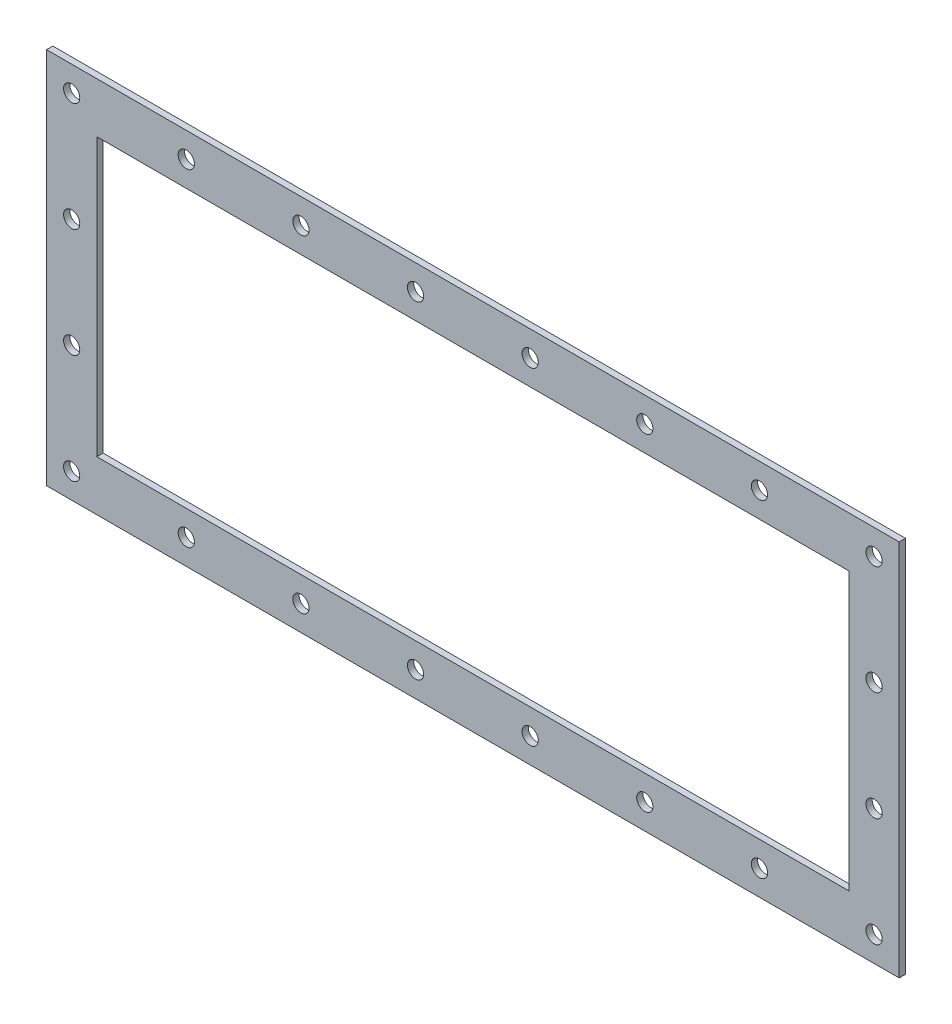
from build123d import *

# Parameters (mm, degrees)
SKETCH1_W           = 107.7
SKETCH1_H           = 47.7
SKETCH1_R           = 1.025
SKETCH1_W_2         = 95
SKETCH1_H_2         = 35
BOSS_EXTRUDE1_DEPTH = 0.79375


with BuildPart() as part:
    # Sketch1 → Boss-Extrude1 (new body)
    with BuildSketch(Plane.XY):
        Rectangle(SKETCH1_W, SKETCH1_H)
        with Locations((-50.675, 20.675)):
            Circle(SKETCH1_R, mode=Mode.SUBTRACT)
        with Locations((50.675, 20.675)):
            Circle(SKETCH1_R, mode=Mode.SUBTRACT)
        with Locations((-50.675, -20.675)):
            Circle(SKETCH1_R, mode=Mode.SUBTRACT)
        with Locations((50.675, -20.675)):
            Circle(SKETCH1_R, mode=Mode.SUBTRACT)
        with Locations((-7.239285714, 20.675)):
            Circle(SKETCH1_R, mode=Mode.SUBTRACT)
        with Locations((-7.239285714, -20.675)):
            Circle(SKETCH1_R, mode=Mode.SUBTRACT)
        with Locations((-36.196428571, 20.675)):
            Circle(SKETCH1_R, mode=Mode.SUBTRACT)
        with Locations((-21.717857143, 20.675)):
            Circle(SKETCH1_R, mode=Mode.SUBTRACT)
        with Locations((7.239285714, 20.675)):
            Circle(SKETCH1_R, mode=Mode.SUBTRACT)
        with Locations((21.717857143, 20.675)):
            Circle(SKETCH1_R, mode=Mode.SUBTRACT)
        with Locations((-50.675, 6.8916667)):
            Circle(SKETCH1_R, mode=Mode.SUBTRACT)
        with Locations((-50.675, -6.8916667)):
            Circle(SKETCH1_R, mode=Mode.SUBTRACT)
        with Locations((50.675, 6.8916667)):
            Circle(SKETCH1_R, mode=Mode.SUBTRACT)
        with Locations((50.675, -6.8916667)):
            Circle(SKETCH1_R, mode=Mode.SUBTRACT)
        with Locations((7.239285714, -20.675)):
            Circle(SKETCH1_R, mode=Mode.SUBTRACT)
        with Locations((21.717857143, -20.675)):
            Circle(SKETCH1_R, mode=Mode.SUBTRACT)
        with Locations((-21.717857143, -20.675)):
            Circle(SKETCH1_R, mode=Mode.SUBTRACT)
        with Locations((-36.196428571, -20.675)):
            Circle(SKETCH1_R, mode=Mode.SUBTRACT)
        with Locations((36.196428572, 20.675)):
            Circle(SKETCH1_R, mode=Mode.SUBTRACT)
        with Locations((36.196428572, -20.675)):
            Circle(SKETCH1_R, mode=Mode.SUBTRACT)
        Rectangle(SKETCH1_W_2, SKETCH1_H_2, mode=Mode.SUBTRACT)
    extrude(amount=BOSS_EXTRUDE1_DEPTH)


solid = part.part
